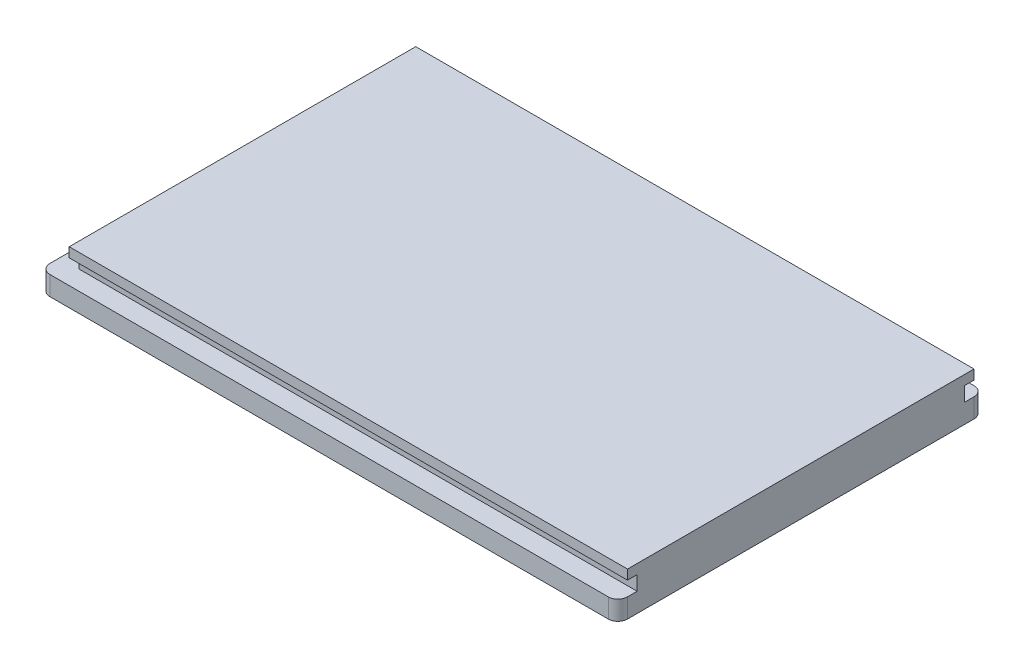
from build123d import *

# Parameters (mm, degrees)
SKETCH1_W           = 150
SKETCH1_H           = 95
BOSS_EXTRUDE1_DEPTH = 5
SKETCH2_W           = 145
SKETCH2_H           = 85
BOSS_EXTRUDE2_DEPTH = 3.75
SKETCH3_W           = 145
SKETCH3_H           = 90
BOSS_EXTRUDE3_DEPTH = 2.5
FILLET2_R           = 2.5


with BuildPart() as part:
    # Sketch1 → Boss-Extrude1 (new body)
    with BuildSketch(Plane(origin=(0, 0, 0), x_dir=(1, 0, 0), z_dir=(0, 1, 0))):
        with Locations((75, 47.5)):
            Rectangle(SKETCH1_W, SKETCH1_H)
    extrude(amount=BOSS_EXTRUDE1_DEPTH)

    # Sketch2 → Boss-Extrude2 (add)
    with BuildSketch(Plane(origin=(0, 5, 0), x_dir=(1, 0, 0), z_dir=(0, 1, 0))):
        with Locations((77.5, 47.5)):
            Rectangle(SKETCH2_W, SKETCH2_H)
    extrude(amount=BOSS_EXTRUDE2_DEPTH)

    # Sketch3 → Boss-Extrude3 (add)
    with BuildSketch(Plane(origin=(0, 8.75, 0), x_dir=(1, 0, 0), z_dir=(0, 1, 0))):
        with Locations((77.5, 47.5)):
            Rectangle(SKETCH3_W, SKETCH3_H)
    extrude(amount=BOSS_EXTRUDE3_DEPTH)

    # Fillet2
    fillet2_edges = [part.edges().sort_by_distance(p)[0] for p in [
        (0, 2.5, -95),
        (150, 2.5, -95),
        (150, 2.5, 0),
        (0, 2.5, 0),
    ]]
    fillet(fillet2_edges, radius=FILLET2_R)


solid = part.part
